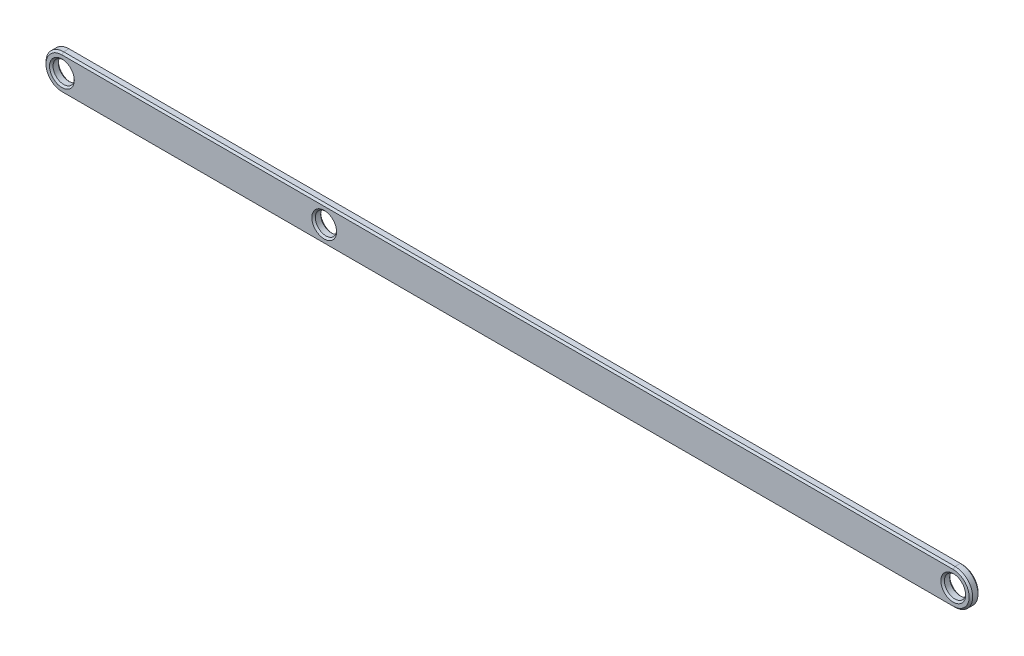
from build123d import *

# Parameters (mm, degrees)
SKETCH1_R           = 30
BOSS_EXTRUDE1_DEPTH = 25
CHAMFER1_SIZE       = 5


with BuildPart() as part:
    # Sketch1 → Boss-Extrude1 (new body)
    with BuildSketch(Plane.XY):
        with BuildLine():
            Line((1260, -50), (-1260, -50))
            ThreePointArc((-1260, -50), (-1310, 0), (-1260, 50))
            Line((-1260, 50), (1260, 50))
            ThreePointArc((1260, 50), (1310, 0), (1260, -50))
        make_face()
        with Locations((-1260, 0)):
            Circle(SKETCH1_R, mode=Mode.SUBTRACT)
        with Locations(Location((1260, 0, 0), (0, 0, 180))):
            Circle(SKETCH1_R, mode=Mode.SUBTRACT)
        with Locations((-518.4, 0)):
            Circle(SKETCH1_R, mode=Mode.SUBTRACT)
    extrude(amount=BOSS_EXTRUDE1_DEPTH)

    # Chamfer1
    chamfer1_edges = [part.edges().sort_by_distance(p)[0] for p in [
        (1310, 0, 25),
        (-1290, 0, 0),
        (-1290, 0, 25),
        (0, 50, 25),
        (1290, 0, 0),
        (1290, 0, 25),
        (-548.4, 0, 0),
        (-548.4, 0, 25),
        (-1310, 0, 25),
        (0, 50, 0),
        (1310, 0, 0),
        (0, -50, 0),
        (-1310, 0, 0),
        (0, -50, 25),
    ]]
    chamfer(chamfer1_edges, length=CHAMFER1_SIZE)


solid = part.part
